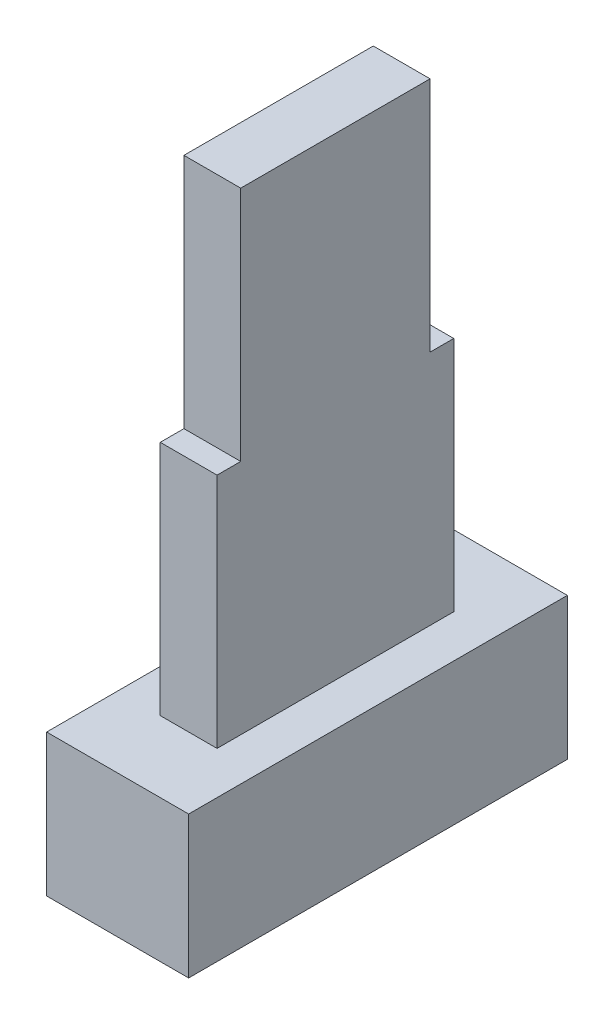
from build123d import *

# Parameters (mm, degrees)
SKETCH_1_W      = 3
SKETCH_1_H      = 8
EXTRUDE_1_DEPTH = 3
SKETCH_2_W      = 1.2
SKETCH_2_H      = 5
EXTRUDE_2_DEPTH = 5
SKETCH_3_W      = 1.2
SKETCH_3_H      = 4
EXTRUDE_3_DEPTH = 5


with BuildPart() as part:
    # 草图1 → 凸台-拉伸1 (new body)
    with BuildSketch(Plane(origin=(0, 0, 0), x_dir=(1, 0, 0), z_dir=(0, 1, 0))):
        Rectangle(SKETCH_1_W, SKETCH_1_H)
    extrude(amount=EXTRUDE_1_DEPTH)

    # 草图2 → 凸台-拉伸2 (add)
    with BuildSketch(Plane(origin=(0, 3, 0), x_dir=(1, 0, 0), z_dir=(0, 1, 0))):
        Rectangle(SKETCH_2_W, SKETCH_2_H)
    extrude(amount=EXTRUDE_2_DEPTH)

    # 草图3 → 凸台-拉伸3 (add)
    with BuildSketch(Plane(origin=(0, 8, 0), x_dir=(1, 0, 0), z_dir=(0, 1, 0))):
        Rectangle(SKETCH_3_W, SKETCH_3_H)
    extrude(amount=EXTRUDE_3_DEPTH)


solid = part.part
